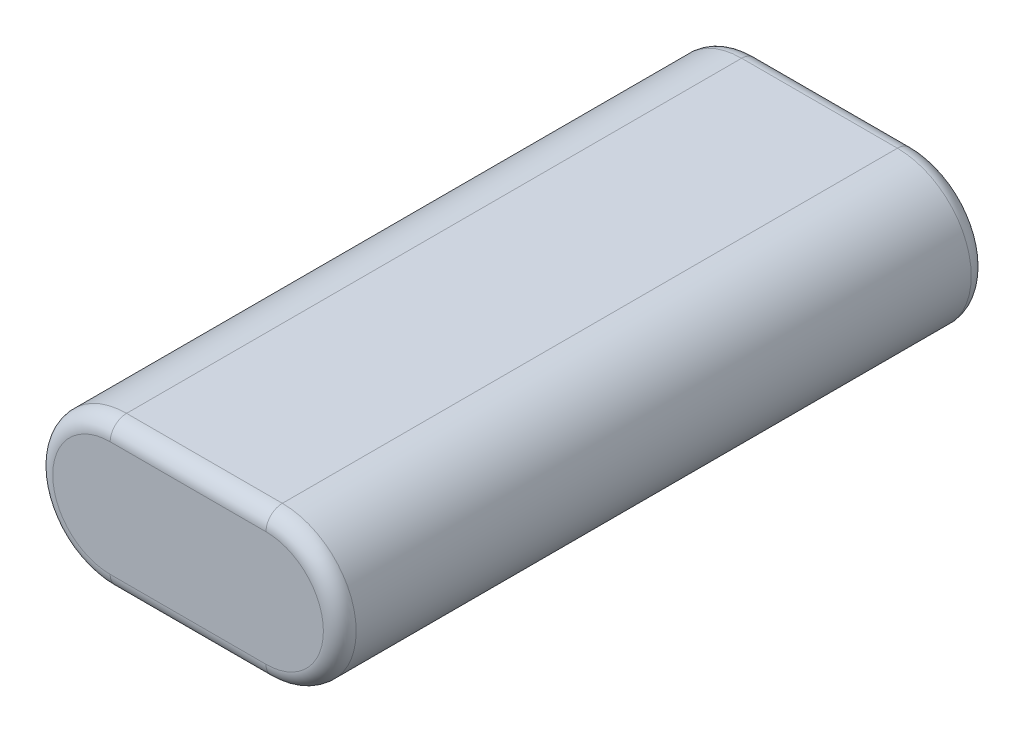
from build123d import *

# Parameters (mm, degrees)
BOSS_EXTRUDE1_DEPTH = 79
FILLET1_R           = 2


with BuildPart() as part:
    # Sketch1 → Boss-Extrude1 (new body)
    with BuildSketch(Plane.XY):
        with BuildLine():
            Line((0, 0), (0, 9))
            ThreePointArc((0, 9), (-9, 0), (0, -9))
            Line((0, -9), (0, 0))
        make_face()
        with BuildLine():
            ThreePointArc((9, 0), (6.363961031, 6.363961031), (0, 9))
            Line((0, 9), (0, 0))
            Line((0, 0), (9, 0))
        make_face()
        with BuildLine():
            Line((19, 9), (0, 9))
            ThreePointArc((0, 9), (6.363961031, 6.363961031), (9, 0))
            Line((9, 0), (10, 0))
            ThreePointArc((10, 0), (12.636038969, 6.363961031), (19, 9))
        make_face()
        with BuildLine():
            Line((19, 0), (19, 9))
            ThreePointArc((19, 9), (12.636038969, 6.363961031), (10, 0))
            Line((10, 0), (19, 0))
        make_face()
        with BuildLine():
            ThreePointArc((28, 0), (25.363961031, 6.363961031), (19, 9))
            Line((19, 9), (19, 0))
            Line((19, 0), (19, -9))
            ThreePointArc((19, -9), (25.363961031, -6.363961031), (28, 0))
        make_face()
        with BuildLine():
            Line((19, -9), (19, 0))
            Line((19, 0), (10, 0))
            ThreePointArc((10, 0), (12.636038969, -6.363961031), (19, -9))
        make_face()
        with BuildLine():
            Line((10, 0), (9, 0))
            ThreePointArc((9, 0), (6.363961031, -6.363961031), (0, -9))
            Line((0, -9), (19, -9))
            ThreePointArc((19, -9), (12.636038969, -6.363961031), (10, 0))
        make_face()
        with BuildLine():
            Line((9, 0), (0, 0))
            Line((0, 0), (0, -9))
            ThreePointArc((0, -9), (6.363961031, -6.363961031), (9, 0))
        make_face()
    extrude(amount=BOSS_EXTRUDE1_DEPTH)

    # Fillet1
    fillet1_edges = [part.edges().sort_by_distance(p)[0] for p in [
        (9.5, 9, 79),
        (-9, 0, 79),
        (9.5, -9, 79),
        (-9, 0, 0),
        (9.5, 9, 0),
        (28, 0, 0),
        (9.5, -9, 0),
        (28, 0, 79),
    ]]
    fillet(fillet1_edges, radius=FILLET1_R)


solid = part.part
